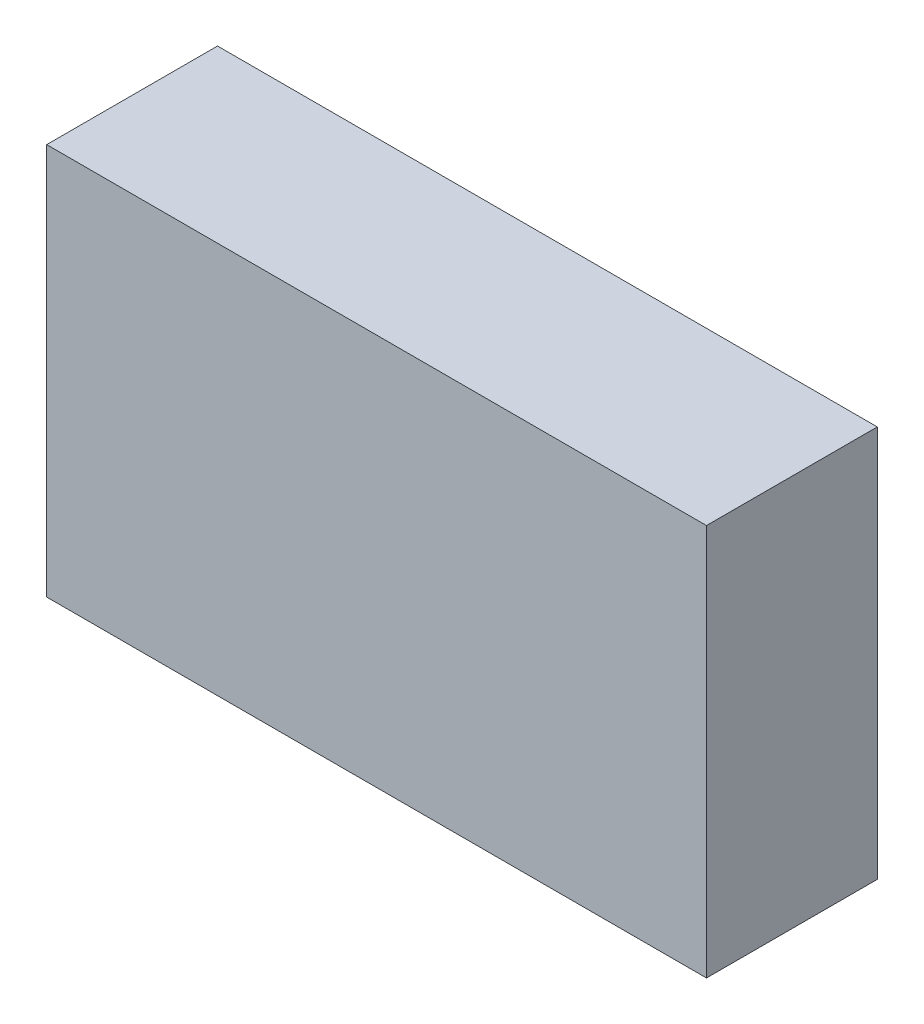
from build123d import *

# Parameters (mm, degrees)
SKETCH1_W           = 19.7
SKETCH1_H           = 11.7
BOSS_EXTRUDE1_DEPTH = 5.1


with BuildPart() as part:
    # Sketch1 → Boss-Extrude1 (new body)
    with BuildSketch(Plane.XY):
        with Locations((9.85, 5.85)):
            Rectangle(SKETCH1_W, SKETCH1_H)
    extrude(amount=BOSS_EXTRUDE1_DEPTH)


solid = part.part
